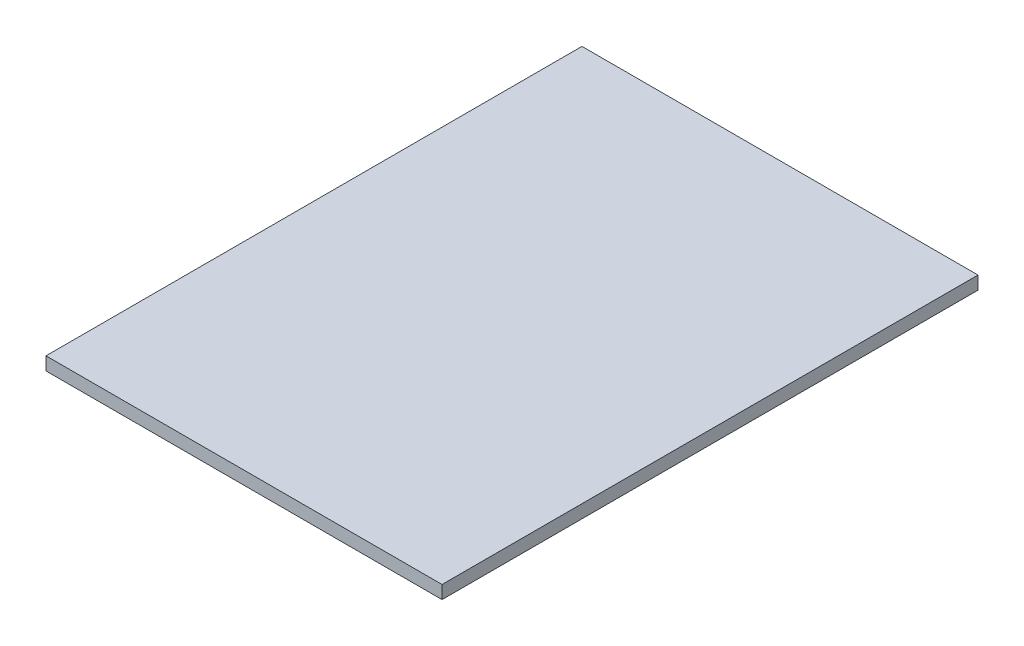
from build123d import *

# Parameters (mm, degrees)
SKETCH1_W           = 150.986730816
SKETCH1_H           = 204.329348289
BOSS_EXTRUDE1_DEPTH = 5


with BuildPart() as part:
    # Sketch1 → Boss-Extrude1 (new body)
    with BuildSketch(Plane(origin=(0, 0, 0), x_dir=(1, 0, 0), z_dir=(0, 1, 0))):
        with Locations((-11.301402007, -4.068504723)):
            Rectangle(SKETCH1_W, SKETCH1_H)
    extrude(amount=BOSS_EXTRUDE1_DEPTH)


solid = part.part
